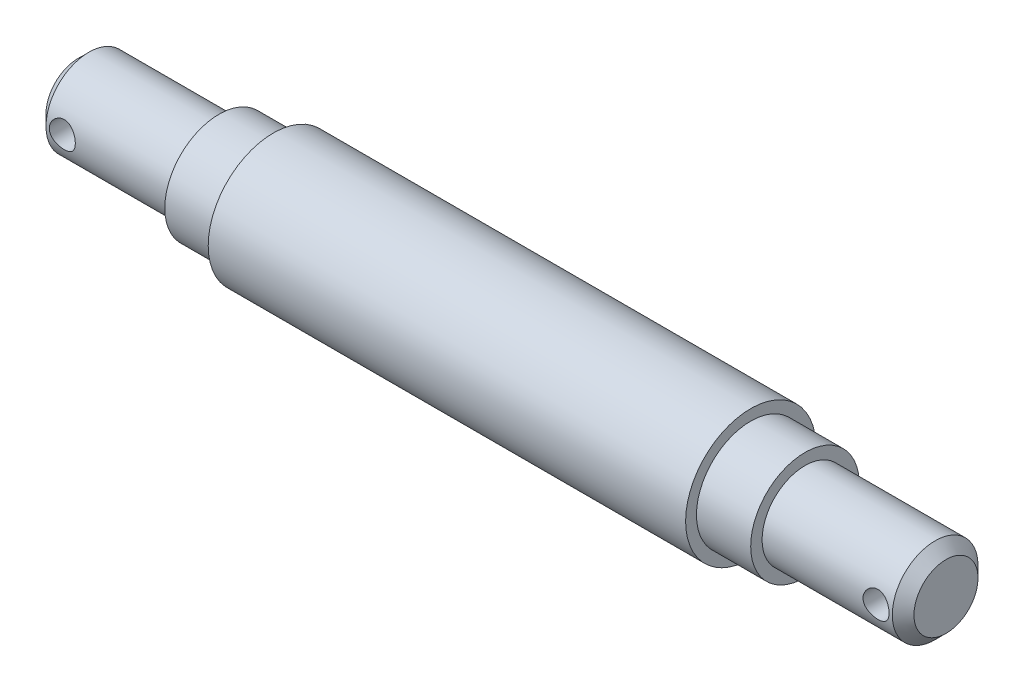
from build123d import *

# Parameters (mm, degrees)
SKETCH2_R          = 1.2
CUT_EXTRUDE1_DEPTH = 10
SKETCH3_R          = 1.2
CUT_EXTRUDE2_DEPTH = 10


with BuildPart() as part:
    # Sketch1 → Revolve1 (revolve)
    with BuildSketch(Plane.XY):
        Polygon((-40, 0), (-40, 2.95), (-39, 3.95), (-27, 3.95), (-27, 5), (-22, 5), (-22, 6), (22, 6), (22, 5), (27, 5), (27, 3.95), (39, 3.95), (40, 2.95), (40, 0), align=None)
    revolve(axis=Axis((-24.25, 0, 0), (1, 0, 0)))

    # Sketch2 → Cut-Extrude1 (cut)
    with BuildSketch(Plane.XY.offset(3.95)):
        with Locations((-37.5, 0)):
            Circle(SKETCH2_R)
    extrude(amount=-CUT_EXTRUDE1_DEPTH, mode=Mode.SUBTRACT)

    # Sketch3 → Cut-Extrude2 (cut)
    with BuildSketch(Plane.XY.offset(3.95)):
        with Locations((37.5, 0)):
            Circle(SKETCH3_R)
    extrude(amount=-CUT_EXTRUDE2_DEPTH, mode=Mode.SUBTRACT)


solid = part.part
